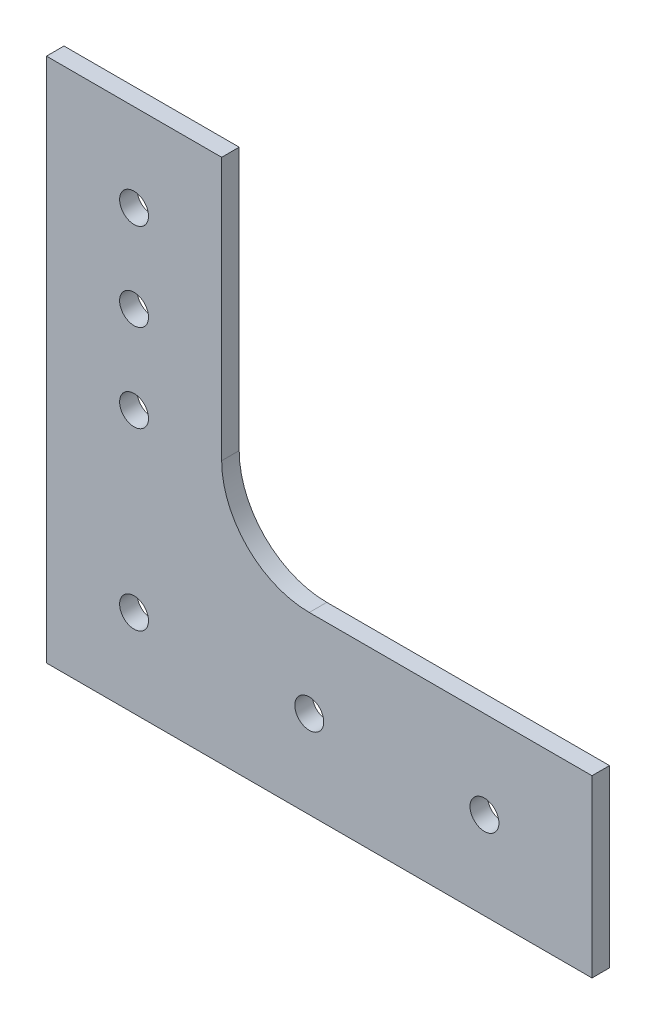
from build123d import *

# Parameters (mm, degrees)
SKETCH_1_R      = 1.65
EXTRUDE_1_DEPTH = 2
FILLET_1_R      = 10


with BuildPart() as part:
    # 草图1 → 凸台-拉伸1 (new body)
    with BuildSketch(Plane.XY):
        Polygon((10, 10), (52.276412277, 10), (52.276412277, -10), (-10, -10), (-10, 10), (-10, 50), (10, 50), align=None)
        with Locations((20, 0)):
            Circle(SKETCH_1_R, mode=Mode.SUBTRACT)
        with Locations((3.0503e-05, 20)):
            Circle(SKETCH_1_R, mode=Mode.SUBTRACT)
        with Locations((3.0503e-05, 40)):
            Circle(SKETCH_1_R, mode=Mode.SUBTRACT)
        with Locations((3.0503e-05, 30)):
            Circle(SKETCH_1_R, mode=Mode.SUBTRACT)
        Circle(SKETCH_1_R, mode=Mode.SUBTRACT)
        with Locations((40, 0)):
            Circle(SKETCH_1_R, mode=Mode.SUBTRACT)
    extrude(amount=EXTRUDE_1_DEPTH)

    # 圆角1
    fillet_1_edges = [part.edges().sort_by_distance(p)[0] for p in [
        (10, 10, 1),
    ]]
    fillet(fillet_1_edges, radius=FILLET_1_R)


solid = part.part
